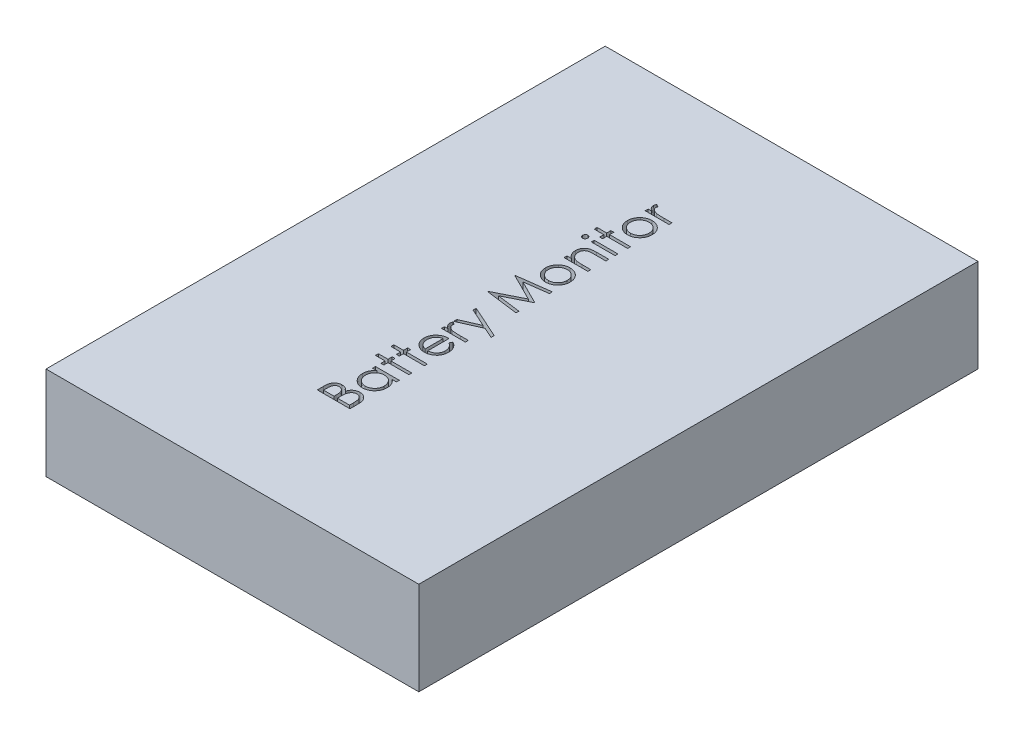
from build123d import *

# Parameters (mm, degrees)
SKETCH1_W           = 40
SKETCH1_H           = 60
BOSS_EXTRUDE1_DEPTH = 10
SKETCH2_W           = 2.557692308
SKETCH2_H           = 0.314102564
CUT_EXTRUDE1_DEPTH  = 2


with BuildPart() as part:
    # Sketch1 → Boss-Extrude1 (new body)
    with BuildSketch(Plane(origin=(0, 0, 0), x_dir=(1, 0, 0), z_dir=(0, 1, 0))):
        Rectangle(SKETCH1_W, SKETCH1_H)
    extrude(amount=BOSS_EXTRUDE1_DEPTH)

    # Sketch2 → Cut-Extrude1 (cut)
    # profile 1 of 15: a face of its own
    with BuildSketch(Plane(origin=(0, 10, 0), x_dir=(1, 0, 0), z_dir=(0, 1, 0))):
        with BuildLine():
            Line((-3.5, -17.387820513), (-3.5, -16.704927885))
            add(Edge.make_bspline(
                [(-3.5, -16.704927885), (-3.499827016, -16.671498879), (-3.499491731, -16.606705147), (-3.494170998, -16.51249287), (-3.487097587, -16.42421924), (-3.47523232, -16.342040248), (-3.462929603, -16.265421167), (-3.44487216, -16.195139841), (-3.424927056, -16.130607579), (-3.394238808, -16.05311754), (-3.346579571, -15.965194473), (-3.275896393, -15.870693627), (-3.191152971, -15.788547726), (-3.094581157, -15.718699361), (-2.988341218, -15.662644562), (-2.874718941, -15.622604427), (-2.755625884, -15.59688112), (-2.673976582, -15.594268894), (-2.63271234, -15.592948718)],
                knots=[0, 0, 0, 0, 1.00128172, 1.940733171, 2.826250472, 3.653024905, 4.427672124, 5.149348099, 5.824709082, 6.450061444, 7.643590664, 8.808605388, 9.972104426, 11.165284501, 12.367876273, 13.557044126, 14.765369432, 16, 16, 16, 16], degree=3))
            add(Edge.make_bspline(
                [(-2.63271234, -15.592948718), (-2.594061484, -15.594048329), (-2.518108906, -15.596209167), (-2.407211066, -15.616620138), (-2.301753702, -15.649015265), (-2.201827071, -15.693786637), (-2.109291316, -15.751472046), (-2.024433087, -15.820587273), (-1.950459558, -15.903628667), (-1.909119745, -15.965876775), (-1.888120994, -15.997495994)],
                knots=[0, 0, 0, 0, 1.044641374, 2.052818814, 3.038628718, 4.023282556, 5.005660861, 5.98021751, 6.974042014, 8, 8, 8, 8], degree=3))
            add(Edge.make_bspline(
                [(-1.888120994, -15.997495994), (-1.872851052, -15.957739405), (-1.84363587, -15.881675204), (-1.792064534, -15.776939381), (-1.73576949, -15.687031894), (-1.675242264, -15.610196446), (-1.609038135, -15.544829368), (-1.536619226, -15.488217699), (-1.458044822, -15.439275808), (-1.37360371, -15.397626597), (-1.284011735, -15.364910622), (-1.190363175, -15.340864835), (-1.093017032, -15.326641228), (-1.026955989, -15.32470091), (-0.993489583, -15.323717949)],
                knots=[0, 0, 0, 0, 1.272586185, 2.434772614, 3.483318042, 4.437947805, 5.351807173, 6.25737843, 7.180033415, 8.1141739, 9.066731021, 10.025721652, 10.999834114, 12, 12, 12, 12], degree=3))
            add(Edge.make_bspline(
                [(-0.993489583, -15.323717949), (-0.959322572, -15.324694581), (-0.89209802, -15.326616133), (-0.793344872, -15.340799155), (-0.698962627, -15.364797053), (-0.608384297, -15.397909437), (-0.521799795, -15.440828598), (-0.439522785, -15.493814705), (-0.361382093, -15.556123939), (-0.28723981, -15.626543446), (-0.21939729, -15.705020476), (-0.161075602, -15.791507215), (-0.110927262, -15.883634346), (-0.070098271, -15.982579628), (-0.038598733, -16.088090474), (-0.016652218, -16.200108171), (-0.001839877, -16.318448244), (-0.000623699, -16.399658589), (0, -16.44130609)],
                knots=[0, 0, 0, 0, 0.978680899, 1.925582087, 2.851223405, 3.764209995, 4.683484765, 5.614004905, 6.562443559, 7.542772147, 8.539900013, 9.527881485, 10.525548727, 11.540192123, 12.58875426, 13.674701727, 14.807505862, 16, 16, 16, 16], degree=3))
            Line((0, -16.44130609), (0, -17.387820513))
            Line((0, -17.387820513), (-3.5, -17.387820513))
        make_face()
        with BuildLine():
            Line((-3.141025641, -17.073717949), (-2.019230769, -17.073717949))
            Line((-2.019230769, -17.073717949), (-2.019230769, -16.862680288))
            add(Edge.make_bspline(
                [(-2.019230769, -16.862680288), (-2.019630692, -16.831831493), (-2.020403425, -16.772225334), (-2.022616943, -16.685905438), (-2.028814983, -16.605780417), (-2.035011254, -16.531988594), (-2.045085813, -16.464646117), (-2.05707803, -16.403902364), (-2.069760632, -16.348803415), (-2.091331398, -16.285265357), (-2.123200398, -16.213182316), (-2.172706503, -16.136389083), (-2.231625018, -16.068375268), (-2.300244736, -16.011630165), (-2.374983675, -15.964778611), (-2.455185698, -15.931957624), (-2.539236842, -15.910076849), (-2.597049479, -15.908070135), (-2.626402244, -15.907051282)],
                knots=[0, 0, 0, 0, 1.156917035, 2.235399477, 3.236897345, 4.169954739, 5.01148057, 5.788325709, 6.491867502, 7.129259015, 8.302032419, 9.437271567, 10.542795419, 11.662606952, 12.764338259, 13.836858145, 14.901724648, 16, 16, 16, 16], degree=3))
            add(Edge.make_bspline(
                [(-2.626402244, -15.907051282), (-2.645830562, -15.907568593), (-2.683941329, -15.908583355), (-2.739678522, -15.917196179), (-2.79205104, -15.931151239), (-2.841561526, -15.950050152), (-2.886979527, -15.975868872), (-2.930475233, -16.00579616), (-2.969443462, -16.042745647), (-3.005760298, -16.084501847), (-3.038263745, -16.132278388), (-3.065187813, -16.187104616), (-3.089589964, -16.247563189), (-3.107654151, -16.315294382), (-3.123538771, -16.388894781), (-3.133519185, -16.469360962), (-3.139941675, -16.556183029), (-3.14065626, -16.616339816), (-3.141025641, -16.647435897)],
                knots=[0, 0, 0, 0, 0.911708768, 1.788416306, 2.640049961, 3.452993646, 4.268229297, 5.087074648, 5.92553149, 6.781184137, 7.681934069, 8.628939405, 9.643570426, 10.73771997, 11.914765019, 13.176320755, 14.540391495, 16, 16, 16, 16], degree=3))
            Line((-3.141025641, -16.647435897), (-3.141025641, -17.073717949))
        make_face(mode=Mode.SUBTRACT)
        with BuildLine():
            Line((-1.66025641, -17.073717949), (-0.358974359, -17.073717949))
            Line((-0.358974359, -17.073717949), (-0.358974359, -16.626402244))
            add(Edge.make_bspline(
                [(-0.358974359, -16.626402244), (-0.359396264, -16.594386666), (-0.36020943, -16.532680862), (-0.362116473, -16.443518122), (-0.369330527, -16.361093696), (-0.375985459, -16.285147566), (-0.387365108, -16.215881293), (-0.398104538, -16.152762077), (-0.414046454, -16.096826064), (-0.435956742, -16.031367986), (-0.471032393, -15.958200986), (-0.522277589, -15.878242624), (-0.585522071, -15.808520172), (-0.657450692, -15.748669955), (-0.735443268, -15.699278957), (-0.818480193, -15.663836244), (-0.904946557, -15.641810879), (-0.963915826, -15.639153312), (-0.993489583, -15.637820513)],
                knots=[0, 0, 0, 0, 1.160376723, 2.23647316, 3.230273494, 4.158083346, 4.997711197, 5.773399541, 6.476071462, 7.102777513, 8.27340052, 9.405620712, 10.53304798, 11.669441455, 12.787990954, 13.865552736, 14.929550474, 16, 16, 16, 16], degree=3))
            add(Edge.make_bspline(
                [(-0.993489583, -15.637820513), (-1.011983322, -15.638095772), (-1.048672494, -15.638641849), (-1.102582506, -15.646914791), (-1.154829834, -15.658883117), (-1.205632199, -15.674645746), (-1.254135426, -15.696681052), (-1.300525527, -15.72369449), (-1.345737015, -15.75461617), (-1.403634242, -15.802322473), (-1.469513255, -15.872724805), (-1.533216158, -15.972774377), (-1.58542007, -16.085906167), (-1.60748965, -16.168151306), (-1.618890224, -16.210637019)],
                knots=[0, 0, 0, 0, 0.723302347, 1.434937762, 2.129609326, 2.821140842, 3.513216847, 4.209993937, 4.920569932, 5.655069131, 7.14393391, 8.6716197, 10.280644748, 12, 12, 12, 12], degree=3))
            add(Edge.make_bspline(
                [(-1.618890224, -16.210637019), (-1.622345308, -16.227666115), (-1.629836643, -16.264588707), (-1.637744346, -16.324796288), (-1.644789406, -16.393532157), (-1.650000564, -16.470955034), (-1.655387107, -16.557162875), (-1.657481929, -16.652339794), (-1.659981189, -16.756097108), (-1.660162323, -16.828089481), (-1.66025641, -16.865484776)],
                knots=[0, 0, 0, 0, 0.634451884, 1.375622551, 2.216452059, 3.157844607, 4.20941857, 5.370758133, 6.634282058, 8, 8, 8, 8], degree=3))
            Line((-1.66025641, -16.865484776), (-1.66025641, -17.073717949))
        make_face(mode=Mode.SUBTRACT)
    # profile 2 of 15: a face of its own
    with BuildSketch(Plane(origin=(0, 10, 0), x_dir=(1, 0, 0), z_dir=(0, 1, 0))):
        with BuildLine():
            Line((-2.557692308, -12.092948718), (0, -12.092948718))
            Line((0, -12.092948718), (0, -12.407051282))
            Line((0, -12.407051282), (-0.442407853, -12.407051282))
            add(Edge.make_bspline(
                [(-0.442407853, -12.407051282), (-0.402434233, -12.442525367), (-0.324309204, -12.51185644), (-0.22130842, -12.626561256), (-0.137906052, -12.749659828), (-0.069567916, -12.878063249), (-0.018442034, -13.013029264), (0.017961997, -13.153852449), (0.041350966, -13.300667344), (0.043687656, -13.400919216), (0.044871795, -13.451722756)],
                knots=[0, 0, 0, 0, 1.074325654, 2.099677833, 3.090439787, 4.057542011, 5.018572219, 5.985274637, 6.979019747, 8, 8, 8, 8], degree=3))
            add(Edge.make_bspline(
                [(0.044871795, -13.451722756), (0.043645423, -13.49689071), (0.041226962, -13.585963915), (0.022464659, -13.716992992), (-0.007665963, -13.843085242), (-0.049566853, -13.964359814), (-0.105147674, -14.08003196), (-0.171688922, -14.191092056), (-0.250929752, -14.296964749), (-0.341517781, -14.396036287), (-0.439912768, -14.487268288), (-0.544858315, -14.56732956), (-0.655900619, -14.63408264), (-0.771633773, -14.689902721), (-0.892948692, -14.732899065), (-1.01942586, -14.7628727), (-1.150915734, -14.781613146), (-1.240455257, -14.784030607), (-1.285857372, -14.78525641)],
                knots=[0, 0, 0, 0, 1.033919861, 2.038935746, 3.024066025, 3.998881131, 4.97069526, 5.957263378, 6.95902576, 7.993208707, 9.027059324, 10.027763471, 11.009749337, 11.988697705, 12.965288445, 13.950418724, 14.960734635, 16, 16, 16, 16], degree=3))
            add(Edge.make_bspline(
                [(-1.285857372, -14.78525641), (-1.330321075, -14.784003439), (-1.418223419, -14.781526382), (-1.547502117, -14.763073162), (-1.672020377, -14.732042154), (-1.791377321, -14.688494306), (-1.905717371, -14.632652351), (-2.015121396, -14.564724264), (-2.119890793, -14.484705139), (-2.21756202, -14.392452732), (-2.307782634, -14.292517962), (-2.38619168, -14.185609231), (-2.453908529, -14.07438595), (-2.507562005, -13.957122939), (-2.550971109, -13.835555834), (-2.581004078, -13.708602389), (-2.598701399, -13.57679081), (-2.601264163, -13.487300318), (-2.602564103, -13.441907051)],
                knots=[0, 0, 0, 0, 1.020392517, 2.01726096, 2.990465484, 3.961182959, 4.928053699, 5.906110375, 6.912531644, 7.948652711, 8.985773172, 9.998621852, 10.987621588, 11.969261332, 12.953316658, 13.946091881, 14.958173133, 16, 16, 16, 16], degree=3))
            add(Edge.make_bspline(
                [(-2.602564103, -13.441907051), (-2.60112475, -13.389708181), (-2.598302246, -13.28734866), (-2.574862161, -13.137606672), (-2.535141118, -12.996013172), (-2.481482841, -12.861065009), (-2.408686533, -12.734619708), (-2.319426341, -12.615103214), (-2.210011935, -12.505058248), (-2.127018146, -12.4402854), (-2.084435096, -12.407051282)],
                knots=[0, 0, 0, 0, 1.039007978, 2.037445607, 3.008437381, 3.96246474, 4.921201921, 5.904967172, 6.925065498, 8, 8, 8, 8], degree=3))
            Line((-2.084435096, -12.407051282), (-2.557692308, -12.407051282))
            Line((-2.557692308, -12.407051282), (-2.557692308, -12.092948718))
        make_face()
        with BuildLine():
            add(Edge.make_bspline(
                [(-2.288461538, -13.437700321), (-2.286826503, -13.48361367), (-2.283599202, -13.57423932), (-2.258445926, -13.707297612), (-2.216485352, -13.834557329), (-2.159435035, -13.95582058), (-2.086337296, -14.067705863), (-2.000214663, -14.1694553), (-1.899613419, -14.257931559), (-1.788133794, -14.334020928), (-1.667961498, -14.395103675), (-1.542380577, -14.438327944), (-1.413564365, -14.466782415), (-1.326203179, -14.469692908), (-1.282351763, -14.471153846)],
                knots=[0, 0, 0, 0, 1.031130969, 2.035288524, 3.029955243, 4.035265425, 5.037320146, 6.024362013, 7.021230137, 8.037832003, 9.049975902, 10.039737725, 11.016035826, 12, 12, 12, 12], degree=3))
            add(Edge.make_bspline(
                [(-1.282351763, -14.471153846), (-1.238764409, -14.469281427), (-1.151760548, -14.465543928), (-1.022955393, -14.438950933), (-0.897656365, -14.39375141), (-0.776518381, -14.332751259), (-0.663949475, -14.255766377), (-0.561541317, -14.167374265), (-0.474071536, -14.065135285), (-0.400797577, -13.952249676), (-0.341644806, -13.831630479), (-0.300476607, -13.704799494), (-0.273899498, -13.574123083), (-0.27079493, -13.485270853), (-0.269230769, -13.440504808)],
                knots=[0, 0, 0, 0, 0.979154007, 1.954470061, 2.941101473, 3.965068436, 4.993389179, 5.998216918, 6.996159742, 8.005560442, 9.015493761, 10.005250788, 10.994993882, 12, 12, 12, 12], degree=3))
            add(Edge.make_bspline(
                [(-0.269230769, -13.440504808), (-0.27090991, -13.395064497), (-0.274249554, -13.304688227), (-0.299260521, -13.171086599), (-0.342149827, -13.041876637), (-0.399788619, -12.917939757), (-0.471579217, -12.802594983), (-0.555626614, -12.699422357), (-0.652700961, -12.611150235), (-0.760626239, -12.537657234), (-0.878190217, -12.479373694), (-1.00322951, -12.436757514), (-1.135997919, -12.411840965), (-1.226858223, -12.408669919), (-1.273237179, -12.407051282)],
                knots=[0, 0, 0, 0, 1.01787422, 2.024450869, 3.03297362, 4.061474925, 5.080076323, 6.069755756, 7.033548292, 8.009625779, 8.9862229, 9.964937832, 10.961217871, 12, 12, 12, 12], degree=3))
            add(Edge.make_bspline(
                [(-1.273237179, -12.407051282), (-1.30857501, -12.408010938), (-1.378131043, -12.409899846), (-1.480258561, -12.424330415), (-1.577992287, -12.447285342), (-1.671434976, -12.479631512), (-1.760069991, -12.522122796), (-1.844533752, -12.573370562), (-1.924386963, -12.634276012), (-1.998530034, -12.703858708), (-2.066156496, -12.78002391), (-2.126520737, -12.860618451), (-2.17610951, -12.946597198), (-2.217150781, -13.036514235), (-2.249809931, -13.130525569), (-2.271597625, -13.229396189), (-2.286557946, -13.332075176), (-2.287820327, -13.402121232), (-2.288461538, -13.437700321)],
                knots=[0, 0, 0, 0, 1.050140795, 2.067009409, 3.05949893, 4.030605086, 5.00011959, 5.97591094, 6.962425594, 7.979863591, 8.993523472, 9.986985069, 10.967611495, 11.937549037, 12.921786183, 13.919465291, 14.943216303, 16, 16, 16, 16], degree=3))
        make_face(mode=Mode.SUBTRACT)
    # profile 3 of 15: a face of its own
    with BuildSketch(Plane(origin=(0, 10, 0), x_dir=(1, 0, 0), z_dir=(0, 1, 0))):
        Polygon((-3.58974359, -11.060897436), (-3.58974359, -10.746794872), (-2.557692308, -10.746794872), (-2.557692308, -10.298076923), (-2.243589744, -10.298076923), (-2.243589744, -10.746794872), (0, -10.746794872), (0, -11.060897436), (-2.243589744, -11.060897436), (-2.243589744, -11.509615385), (-2.557692308, -11.509615385), (-2.557692308, -11.060897436), align=None)
    # profile 4 of 15: a face of its own
    with BuildSketch(Plane(origin=(0, 10, 0), x_dir=(1, 0, 0), z_dir=(0, 1, 0))):
        Polygon((-3.58974359, -9.400641026), (-3.58974359, -9.086538462), (-2.557692308, -9.086538462), (-2.557692308, -8.637820513), (-2.243589744, -8.637820513), (-2.243589744, -9.086538462), (0, -9.086538462), (0, -9.400641026), (-2.243589744, -9.400641026), (-2.243589744, -9.849358974), (-2.557692308, -9.849358974), (-2.557692308, -9.400641026), align=None)
    # profile 5 of 15: a face of its own
    with BuildSketch(Plane(origin=(0, 10, 0), x_dir=(1, 0, 0), z_dir=(0, 1, 0))):
        with BuildLine():
            Line((-0.807692308, -5.955328526), (-0.661157853, -5.676282051))
            add(Edge.make_bspline(
                [(-0.661157853, -5.676282051), (-0.621723871, -5.698530312), (-0.54500096, -5.741816618), (-0.439586991, -5.81595354), (-0.345319457, -5.894382008), (-0.26370785, -5.979488285), (-0.191634668, -6.068707762), (-0.129467518, -6.163734993), (-0.07608468, -6.263794328), (-0.032342426, -6.369987873), (0.002045853, -6.482188416), (0.027441832, -6.601047025), (0.042169086, -6.727124907), (0.043956532, -6.81346287), (0.044871795, -6.857672276)],
                knots=[0, 0, 0, 0, 1.120611642, 2.180266485, 3.186550691, 4.152466804, 5.095166165, 6.022949561, 6.960161436, 7.899497276, 8.862391909, 9.862399089, 10.905440174, 12, 12, 12, 12], degree=3))
            add(Edge.make_bspline(
                [(0.044871795, -6.857672276), (0.04372462, -6.906814253), (0.041486813, -7.002676015), (0.022194349, -7.142215763), (-0.009278012, -7.273595177), (-0.053243547, -7.396806895), (-0.110670893, -7.511549095), (-0.180630295, -7.618050146), (-0.26276285, -7.71686893), (-0.357778154, -7.804895955), (-0.459464338, -7.884129391), (-0.565404947, -7.954092971), (-0.675233097, -8.0123127), (-0.788295336, -8.060394679), (-0.90433474, -8.09832225), (-1.024015882, -8.125274166), (-1.146864189, -8.140667314), (-1.229959798, -8.143036728), (-1.271834936, -8.144230769)],
                knots=[0, 0, 0, 0, 1.14524686, 2.234044844, 3.276713788, 4.290115724, 5.276966211, 6.260758605, 7.254862358, 8.264742877, 9.274005885, 10.257798278, 11.220590477, 12.167824544, 13.118936889, 14.062732937, 15.023735098, 16, 16, 16, 16], degree=3))
            add(Edge.make_bspline(
                [(-1.271834936, -8.144230769), (-1.311129766, -8.143171628), (-1.389006931, -8.14107255), (-1.504272476, -8.127841762), (-1.616300928, -8.104393469), (-1.725185376, -8.072217145), (-1.83074351, -8.030665899), (-1.933039574, -7.97983368), (-2.031964713, -7.919641302), (-2.094367847, -7.873168628), (-2.125801282, -7.849759615)],
                knots=[0, 0, 0, 0, 1.024358464, 2.0301432, 3.019427413, 4.004406732, 4.986367066, 5.972626655, 6.978780325, 8, 8, 8, 8], degree=3))
            add(Edge.make_bspline(
                [(-2.125801282, -7.849759615), (-2.163732941, -7.818106596), (-2.238272838, -7.755904919), (-2.335322662, -7.649608159), (-2.418340489, -7.536058379), (-2.486066597, -7.414113405), (-2.538158683, -7.283978646), (-2.575211094, -7.146325327), (-2.598266796, -7.000772979), (-2.601109889, -6.900995252), (-2.602564103, -6.849959936)],
                knots=[0, 0, 0, 0, 1.030811313, 2.025658015, 2.997072178, 3.962767568, 4.930766827, 5.917075773, 6.934604948, 8, 8, 8, 8], degree=3))
            add(Edge.make_bspline(
                [(-2.602564103, -6.849959936), (-2.601216835, -6.797509315), (-2.598573804, -6.694613153), (-2.573851652, -6.544623642), (-2.535122917, -6.402421735), (-2.478696987, -6.269180954), (-2.408753193, -6.142848252), (-2.320347513, -6.026331164), (-2.218020567, -5.916431219), (-2.13924476, -5.852529335), (-2.099158654, -5.820012019)],
                knots=[0, 0, 0, 0, 1.056389096, 2.072394598, 3.055233004, 4.020130009, 4.981825462, 5.957811105, 6.960805292, 8, 8, 8, 8], degree=3))
            add(Edge.make_bspline(
                [(-2.099158654, -5.820012019), (-2.068955072, -5.797885081), (-2.008748954, -5.753778488), (-1.910577797, -5.698531388), (-1.807867202, -5.650573993), (-1.698956905, -5.612241032), (-1.585137325, -5.581201531), (-1.46559478, -5.558744712), (-1.340364869, -5.545575093), (-1.255038314, -5.542986396), (-1.211538462, -5.541666667)],
                knots=[0, 0, 0, 0, 0.94817472, 1.890038105, 2.849395472, 3.817997239, 4.812318967, 5.836947057, 6.897266129, 8, 8, 8, 8], degree=3))
            Line((-1.211538462, -5.541666667), (-1.211538462, -7.830128205))
            add(Edge.make_bspline(
                [(-1.211538462, -7.830128205), (-1.177837997, -7.828588599), (-1.111567394, -7.825561025), (-1.01459661, -7.811445882), (-0.922223268, -7.789197108), (-0.835140226, -7.757928045), (-0.752210099, -7.7200612), (-0.674048062, -7.673675483), (-0.601010132, -7.618335929), (-0.532442994, -7.55661023), (-0.471382233, -7.487903134), (-0.416730457, -7.415620387), (-0.37092486, -7.338726822), (-0.33374497, -7.257828739), (-0.304638654, -7.173056954), (-0.284770834, -7.084384758), (-0.271463727, -6.991986642), (-0.269984061, -6.929000908), (-0.269230769, -6.896935096)],
                knots=[0, 0, 0, 0, 1.094153842, 2.151609401, 3.174256925, 4.172055639, 5.149267565, 6.128595816, 7.11444997, 8.118368179, 9.117203808, 10.09244225, 11.054858984, 12.015122123, 12.976791628, 13.957293641, 14.960065497, 16, 16, 16, 16], degree=3))
            add(Edge.make_bspline(
                [(-0.269230769, -6.896935096), (-0.269833929, -6.865582581), (-0.271030715, -6.803373175), (-0.282834755, -6.710752469), (-0.301543133, -6.619471648), (-0.328488888, -6.530437108), (-0.360042003, -6.444946416), (-0.397179816, -6.365339997), (-0.439521127, -6.29267029), (-0.487636723, -6.224485955), (-0.546687196, -6.158708548), (-0.61966842, -6.092424039), (-0.707408148, -6.022918314), (-0.773006325, -5.978706278), (-0.807692308, -5.955328526)],
                knots=[0, 0, 0, 0, 0.991168677, 1.966668791, 2.94808785, 3.9350306, 4.905702032, 5.828266021, 6.709360349, 7.562606342, 8.463112863, 9.498839253, 10.677475166, 12, 12, 12, 12], degree=3))
        make_face()
        with BuildLine():
            add(Edge.make_bspline(
                [(-1.525641026, -5.855769231), (-1.567324719, -5.867219299), (-1.647343869, -5.88919971), (-1.75811233, -5.936010814), (-1.857124106, -5.987458864), (-1.942733842, -6.049392191), (-2.018888471, -6.118879009), (-2.084375044, -6.200249753), (-2.144732764, -6.28997528), (-2.194996376, -6.389842742), (-2.236300966, -6.495913863), (-2.266672607, -6.606008464), (-2.284525968, -6.719204401), (-2.287143515, -6.795444608), (-2.288461538, -6.833834135)],
                knots=[0, 0, 0, 0, 1.155085888, 2.217389643, 3.210301801, 4.133263417, 5.03575695, 5.95948047, 6.920061569, 7.923798377, 8.943125483, 9.960783337, 10.973185325, 12, 12, 12, 12], degree=3))
            add(Edge.make_bspline(
                [(-2.288461538, -6.833834135), (-2.287857, -6.865185969), (-2.286661954, -6.927161953), (-2.275088768, -7.018428409), (-2.256491944, -7.106303742), (-2.229148178, -7.190525648), (-2.195876219, -7.271652801), (-2.154978249, -7.349626582), (-2.105531888, -7.423444623), (-2.067760071, -7.469580794), (-2.048677885, -7.492888622)],
                knots=[0, 0, 0, 0, 1.048823158, 2.073302879, 3.073550078, 4.050623576, 5.03253758, 6.005186856, 6.992227572, 8, 8, 8, 8], degree=3))
            add(Edge.make_bspline(
                [(-2.048677885, -7.492888622), (-2.033585155, -7.50958452), (-2.00304115, -7.543372949), (-1.950387182, -7.588472636), (-1.893576633, -7.631976026), (-1.83012967, -7.670635127), (-1.761886187, -7.707374864), (-1.688348228, -7.740854289), (-1.609205387, -7.771295333), (-1.554028674, -7.788383736), (-1.525641026, -7.797175481)],
                knots=[0, 0, 0, 0, 0.879905587, 1.780714457, 2.708106151, 3.677566983, 4.684151534, 5.740052498, 6.837288539, 8, 8, 8, 8], degree=3))
            Line((-1.525641026, -7.797175481), (-1.525641026, -5.855769231))
        make_face(mode=Mode.SUBTRACT)
    # profile 6 of 15: a face of its own
    with BuildSketch(Plane(origin=(0, 10, 0), x_dir=(1, 0, 0), z_dir=(0, 1, 0))):
        with BuildLine():
            Line((-2.557692308, -5.003205128), (-2.557692308, -4.689102564))
            Line((-2.557692308, -4.689102564), (-2.181189904, -4.689102564))
            add(Edge.make_bspline(
                [(-2.181189904, -4.689102564), (-2.216261426, -4.665928643), (-2.283335439, -4.621608698), (-2.371926058, -4.54759888), (-2.446113212, -4.472599306), (-2.504482141, -4.394640624), (-2.548594798, -4.314487159), (-2.57959138, -4.232814802), (-2.598813304, -4.149423835), (-2.601312162, -4.093248373), (-2.602564103, -4.065104167)],
                knots=[0, 0, 0, 0, 1.280091057, 2.448164201, 3.510831157, 4.48793739, 5.405868014, 6.289422536, 7.142991551, 8, 8, 8, 8], degree=3))
            add(Edge.make_bspline(
                [(-2.602564103, -4.065104167), (-2.601373576, -4.04327784), (-2.59892399, -3.998368755), (-2.581713165, -3.930386165), (-2.554235143, -3.860342713), (-2.52839492, -3.815200326), (-2.514923878, -3.791666667)],
                knots=[0, 0, 0, 0, 0.901110191, 1.854092781, 2.881294221, 4, 4, 4, 4], degree=3))
            Line((-2.514923878, -3.791666667), (-2.242888622, -3.964142628))
            add(Edge.make_bspline(
                [(-2.242888622, -3.964142628), (-2.249628888, -3.979251649), (-2.262423203, -4.007931464), (-2.277565213, -4.04988603), (-2.286481129, -4.088567367), (-2.287831847, -4.113210925), (-2.288461538, -4.124699519)],
                knots=[0, 0, 0, 0, 1.180555205, 2.24091978, 3.179933427, 4, 4, 4, 4], degree=3))
            add(Edge.make_bspline(
                [(-2.288461538, -4.124699519), (-2.286794658, -4.14991282), (-2.283394705, -4.201340646), (-2.256284039, -4.27659198), (-2.213741221, -4.350267355), (-2.165297528, -4.408215589), (-2.118763125, -4.453242453), (-2.078035261, -4.485624631), (-2.031944456, -4.514688119), (-1.982272224, -4.542880473), (-1.927771932, -4.569073299), (-1.868354671, -4.592480436), (-1.804511084, -4.614370616), (-1.76011915, -4.626698156), (-1.737379808, -4.633012821)],
                knots=[0, 0, 0, 0, 1.125322384, 2.295331465, 3.535939348, 4.916963136, 5.656144286, 6.429838446, 7.238666481, 8.090384391, 8.983239461, 9.940052224, 10.944811494, 12, 12, 12, 12], degree=3))
            add(Edge.make_bspline(
                [(-1.737379808, -4.633012821), (-1.717103757, -4.637753393), (-1.671968634, -4.648306054), (-1.596591234, -4.658292447), (-1.507592607, -4.66855683), (-1.404869363, -4.675566371), (-1.288026631, -4.682187817), (-1.157568472, -4.685845776), (-1.013136318, -4.688986181), (-0.912395458, -4.689062532), (-0.859575321, -4.689102564)],
                knots=[0, 0, 0, 0, 0.566841273, 1.261806378, 2.068780918, 3.007109044, 4.065315289, 5.256255371, 6.561408263, 8, 8, 8, 8], degree=3))
            Line((-0.859575321, -4.689102564), (0, -4.689102564))
            Line((0, -4.689102564), (0, -5.003205128))
            Line((0, -5.003205128), (-2.557692308, -5.003205128))
        make_face()
    # profile 7 of 15: a face of its own
    with BuildSketch(Plane(origin=(0, 10, 0), x_dir=(1, 0, 0), z_dir=(0, 1, 0))):
        Polygon((-2.557692308, -3.701923077), (-2.557692308, -3.36328125), (-0.598758013, -2.497395833), (-2.557692308, -1.618189103), (-2.557692308, -1.278846154), (0.942307692, -2.849358974), (0.942307692, -3.188701923), (-0.218048878, -2.667768429), align=None)
    # profile 8 of 15: a face of its own
    with BuildSketch(Plane(origin=(0, 10, 0), x_dir=(1, 0, 0), z_dir=(0, 1, 0))):
        Polygon((0, 0.426282051), (-3.5, 0.888321314), (-3.5, 0.933193109), (-0.628205128, 2.378205128), (-3.5, 3.819711538), (-3.5, 3.865284455), (0, 4.330128205), (0, 4.014623397), (-2.518429487, 3.679487179), (0, 2.416065705), (0, 2.345252404), (-2.524038462, 1.076923077), (0, 0.742487981), align=None)
    # profile 9 of 15: a face of its own
    with BuildSketch(Plane(origin=(0, 10, 0), x_dir=(1, 0, 0), z_dir=(0, 1, 0))):
        with BuildLine():
            add(Edge.make_bspline(
                [(-2.602564103, 6.193709936), (-2.601542211, 6.241701209), (-2.599538533, 6.335800366), (-2.578123567, 6.473608252), (-2.545376203, 6.605153388), (-2.500104641, 6.73093958), (-2.43942269, 6.849355876), (-2.367013399, 6.96212712), (-2.281230805, 7.068944129), (-2.214872737, 7.132967158), (-2.181189904, 7.165464744)],
                knots=[0, 0, 0, 0, 1.054011418, 2.066658804, 3.057071809, 4.030435133, 4.997543892, 5.974964718, 6.972108034, 8, 8, 8, 8], degree=3))
            add(Edge.make_bspline(
                [(-2.181189904, 7.165464744), (-2.148975918, 7.193446698), (-2.085171376, 7.248869078), (-1.981715763, 7.319934797), (-1.874575662, 7.381156357), (-1.762328336, 7.430219318), (-1.645953664, 7.468904342), (-1.525051653, 7.496370038), (-1.399889306, 7.512706973), (-1.314885468, 7.51490994), (-1.271834936, 7.516025641)],
                knots=[0, 0, 0, 0, 1.025258237, 2.030674902, 3.01204498, 3.988269485, 4.97094183, 5.956517959, 6.965070386, 8, 8, 8, 8], degree=3))
            add(Edge.make_bspline(
                [(-1.271834936, 7.516025641), (-1.228534878, 7.515044304), (-1.142971945, 7.513105135), (-1.016952579, 7.494761519), (-0.894757756, 7.466230433), (-0.776899063, 7.425398595), (-0.663016235, 7.373040486), (-0.553606686, 7.309149798), (-0.448454553, 7.233278181), (-0.348452714, 7.147274184), (-0.2562865, 7.052222308), (-0.17595823, 6.94910616), (-0.107136706, 6.839952126), (-0.05170029, 6.723308773), (-0.00799059, 6.600241286), (0.022709427, 6.470484218), (0.04127111, 6.334239148), (0.043654684, 6.241211926), (0.044871795, 6.193709936)],
                knots=[0, 0, 0, 0, 0.998656419, 1.973391657, 2.932242238, 3.890759089, 4.846373663, 5.82037756, 6.809684879, 7.83454468, 8.860553229, 9.859544525, 10.845671541, 11.83227036, 12.833544569, 13.85385346, 14.904124723, 16, 16, 16, 16], degree=3))
            add(Edge.make_bspline(
                [(0.044871795, 6.193709936), (0.043650599, 6.145975216), (0.041258824, 6.052484357), (0.022781541, 5.915758375), (-0.007976441, 5.785768756), (-0.051843934, 5.662540157), (-0.107138478, 5.54539531), (-0.175750167, 5.435608813), (-0.256310322, 5.332408898), (-0.348446259, 5.237336913), (-0.448456216, 5.151338308), (-0.553606254, 5.0754653), (-0.663016348, 5.011574974), (-0.776899033, 4.95921677), (-0.894757764, 4.918384957), (-1.016952577, 4.889853864), (-1.142971945, 4.87151025), (-1.228534878, 4.869571081), (-1.271834936, 4.868589744)],
                knots=[0, 0, 0, 0, 1.099876186, 2.154163076, 3.173186993, 4.173200201, 5.163417411, 6.152872554, 7.150605724, 8.17532212, 9.198891216, 10.186952605, 11.159729845, 12.11414092, 13.071450619, 14.029093627, 15.002601286, 16, 16, 16, 16], degree=3))
            add(Edge.make_bspline(
                [(-1.271834936, 4.868589744), (-1.314652437, 4.869710385), (-1.399423731, 4.871929063), (-1.52433693, 4.888288293), (-1.644868911, 4.915455141), (-1.760608083, 4.95467645), (-1.872585626, 5.003648335), (-1.98011856, 5.064253727), (-2.083122115, 5.136006887), (-2.146842045, 5.191213953), (-2.179086538, 5.219150641)],
                knots=[0, 0, 0, 0, 1.031377469, 2.041950136, 3.029500481, 4.003457997, 4.981637986, 5.969878303, 6.97268806, 8, 8, 8, 8], degree=3))
            add(Edge.make_bspline(
                [(-2.179086538, 5.219150641), (-2.213061478, 5.251599232), (-2.279879174, 5.315415096), (-2.365411698, 5.422763824), (-2.439327772, 5.535257645), (-2.498803987, 5.654982571), (-2.545642505, 5.780665429), (-2.57820802, 5.912884671), (-2.599461375, 6.051160187), (-2.601519553, 6.145719808), (-2.602564103, 6.193709936)],
                knots=[0, 0, 0, 0, 1.027980169, 2.021703884, 2.998553061, 3.971491411, 4.943284454, 5.930300938, 6.949603206, 8, 8, 8, 8], degree=3))
        make_face()
        with BuildLine():
            add(Edge.make_bspline(
                [(-2.288461538, 6.192307692), (-2.287496947, 6.158370081), (-2.285592664, 6.091370952), (-2.271108759, 5.992751368), (-2.248161257, 5.897811211), (-2.215557194, 5.806370381), (-2.173458319, 5.718737155), (-2.121749868, 5.634827953), (-2.061117263, 5.554394738), (-1.99165323, 5.479015677), (-1.915779287, 5.409822224), (-1.834912684, 5.349384487), (-1.750292131, 5.297703713), (-1.66179029, 5.255431907), (-1.569105401, 5.223012434), (-1.47278329, 5.20003938), (-1.372533096, 5.185528954), (-1.304369985, 5.1836481), (-1.269731571, 5.182692308)],
                knots=[0, 0, 0, 0, 1.02155314, 2.01673505, 2.994700672, 3.958461264, 4.934171024, 5.916582427, 6.921469794, 7.962398674, 8.998583302, 10.009097305, 10.997513862, 11.97957236, 12.956600784, 13.948243505, 14.957359924, 16, 16, 16, 16], degree=3))
            add(Edge.make_bspline(
                [(-1.269731571, 5.182692308), (-1.224979543, 5.184299131), (-1.136155138, 5.187488376), (-1.005344015, 5.213423612), (-0.879762163, 5.256809892), (-0.760145777, 5.315397172), (-0.649473499, 5.38880339), (-0.550802015, 5.475290457), (-0.465616203, 5.573930158), (-0.394935358, 5.683546658), (-0.338775602, 5.801900976), (-0.298976626, 5.927157297), (-0.273104934, 6.057797991), (-0.270533459, 6.147078722), (-0.269230769, 6.192307692)],
                knots=[0, 0, 0, 0, 1.016792936, 2.018143844, 3.017858371, 4.030088057, 5.03801393, 6.028138512, 7.003788237, 7.991172063, 8.984598303, 9.972568034, 10.972917682, 12, 12, 12, 12], degree=3))
            add(Edge.make_bspline(
                [(-0.269230769, 6.192307692), (-0.270541049, 6.237534061), (-0.273127506, 6.326809657), (-0.298846326, 6.457268834), (-0.338949987, 6.582182806), (-0.394872197, 6.700414193), (-0.465884611, 6.809980797), (-0.550320988, 6.909329918), (-0.64973484, 6.995078529), (-0.760292369, 7.068412134), (-0.879576721, 7.127958877), (-1.005367193, 7.171142079), (-1.136149235, 7.197139665), (-1.224977566, 7.200320493), (-1.269731571, 7.201923077)],
                knots=[0, 0, 0, 0, 1.02726834, 2.027799167, 3.010890988, 4.004497153, 4.992059811, 5.971914811, 6.958719428, 7.966827853, 8.981595046, 9.981490638, 10.983022906, 12, 12, 12, 12], degree=3))
            add(Edge.make_bspline(
                [(-1.269731571, 7.201923077), (-1.304370192, 7.200967614), (-1.37253371, 7.199087409), (-1.472780943, 7.184572264), (-1.569113987, 7.161616636), (-1.661758671, 7.129133081), (-1.750521749, 7.087049045), (-1.834664636, 7.034374767), (-1.916059349, 6.974183883), (-1.991407949, 6.904155624), (-2.06114434, 6.828855239), (-2.12177338, 6.748389429), (-2.173231066, 6.66460465), (-2.215917283, 6.577226015), (-2.247864629, 6.485773461), (-2.271241259, 6.390966328), (-2.285531456, 6.292767519), (-2.287478598, 6.226008476), (-2.288461538, 6.192307692)],
                knots=[0, 0, 0, 0, 1.042975879, 2.052417305, 3.044379404, 4.0217225, 5.00409729, 5.996508862, 7.007348322, 8.048612455, 9.089876587, 10.095087598, 11.077815406, 12.047498138, 13.018202342, 13.98964644, 14.985148868, 16, 16, 16, 16], degree=3))
        make_face(mode=Mode.SUBTRACT)
    # profile 10 of 15: a face of its own
    with BuildSketch(Plane(origin=(0, 10, 0), x_dir=(1, 0, 0), z_dir=(0, 1, 0))):
        with BuildLine():
            Line((-2.557692308, 8.144230769), (-2.557692308, 8.458333333))
            Line((-2.557692308, 8.458333333), (-2.096354167, 8.458333333))
            add(Edge.make_bspline(
                [(-2.096354167, 8.458333333), (-2.138259455, 8.491813075), (-2.219450404, 8.556679638), (-2.325322597, 8.665816274), (-2.414166302, 8.779613315), (-2.484117946, 8.899919005), (-2.537022548, 9.025495371), (-2.575173001, 9.155986094), (-2.598061986, 9.292097456), (-2.60105165, 9.384662349), (-2.602564103, 9.431490385)],
                knots=[0, 0, 0, 0, 1.127869841, 2.185233117, 3.191641716, 4.159226741, 5.10472073, 6.052603964, 7.014823782, 8, 8, 8, 8], degree=3))
            add(Edge.make_bspline(
                [(-2.602564103, 9.431490385), (-2.600920109, 9.478844895), (-2.597700803, 9.571575555), (-2.569252618, 9.706083177), (-2.524495803, 9.832477895), (-2.460946021, 9.948896669), (-2.382464341, 10.054090635), (-2.290894531, 10.146145937), (-2.186120249, 10.222907414), (-2.088348776, 10.274215599), (-2.001464733, 10.307371333), (-1.927156305, 10.329164837), (-1.844332361, 10.34679483), (-1.75319979, 10.362592458), (-1.65339191, 10.373131095), (-1.545147134, 10.381484963), (-1.428484143, 10.387460243), (-1.347797639, 10.387697939), (-1.306189904, 10.387820513)],
                knots=[0, 0, 0, 0, 1.235846195, 2.420061613, 3.574938557, 4.72781258, 5.870749808, 6.993217613, 8.10690044, 9.251157787, 9.865716151, 10.534141144, 11.271861846, 12.076851687, 12.949307443, 13.892392281, 14.913166647, 16, 16, 16, 16], degree=3))
            Line((-1.306189904, 10.387820513), (0, 10.387820513))
            Line((0, 10.387820513), (0, 10.073717949))
            Line((0, 10.073717949), (-1.203125, 10.073717949))
            add(Edge.make_bspline(
                [(-1.203125, 10.073717949), (-1.237947495, 10.07352554), (-1.304557001, 10.073157496), (-1.399925376, 10.071981473), (-1.486180825, 10.06921317), (-1.563571239, 10.065163262), (-1.631813366, 10.059494414), (-1.691252631, 10.053425809), (-1.741362537, 10.046065484), (-1.77152758, 10.039502072), (-1.78505609, 10.036558494)],
                knots=[0, 0, 0, 0, 1.430803381, 2.736883362, 3.918614142, 4.976458302, 5.92063272, 6.731858525, 7.431260095, 8, 8, 8, 8], degree=3))
            add(Edge.make_bspline(
                [(-1.78505609, 10.036558494), (-1.824795804, 10.025985705), (-1.901079039, 10.005690479), (-2.004374389, 9.954520462), (-2.093030698, 9.891402794), (-2.165224631, 9.81320145), (-2.221425751, 9.722016726), (-2.260391137, 9.617697035), (-2.284769891, 9.501322033), (-2.287196662, 9.419467122), (-2.288461538, 9.376802885)],
                knots=[0, 0, 0, 0, 1.084232, 2.08126119, 3.027460722, 3.945137793, 4.874029258, 5.839697328, 6.874011781, 8, 8, 8, 8], degree=3))
            add(Edge.make_bspline(
                [(-2.288461538, 9.376802885), (-2.287992381, 9.351532955), (-2.287063931, 9.301524418), (-2.27751279, 9.227407192), (-2.262414052, 9.155292976), (-2.240162758, 9.085345943), (-2.212851267, 9.017339079), (-2.179994601, 8.950795056), (-2.13954707, 8.887249517), (-2.094328751, 8.825656787), (-2.044256989, 8.768341112), (-1.991410553, 8.715013515), (-1.935135453, 8.667475301), (-1.876335372, 8.624406677), (-1.81420357, 8.5872284), (-1.749339254, 8.554775315), (-1.681657107, 8.52723962), (-1.634682046, 8.513556927), (-1.611177885, 8.506710737)],
                knots=[0, 0, 0, 0, 1.023827899, 2.026128959, 3.023898047, 4.006668367, 4.997079741, 5.992687789, 7.009920206, 8.046337072, 9.087246971, 10.092051999, 11.086713115, 12.070168086, 13.043348831, 14.017773728, 15.008185103, 16, 16, 16, 16], degree=3))
            add(Edge.make_bspline(
                [(-1.611177885, 8.506710737), (-1.593922682, 8.502771089), (-1.556359007, 8.49419468), (-1.494714588, 8.4849315), (-1.423404613, 8.476523924), (-1.342512296, 8.469486966), (-1.251754421, 8.465181549), (-1.151518583, 8.460487153), (-1.041405094, 8.458778092), (-0.964743402, 8.458485738), (-0.924779647, 8.458333333)],
                knots=[0, 0, 0, 0, 0.615963638, 1.340920617, 2.168419149, 3.115676021, 4.16674242, 5.331190069, 6.6087489, 8, 8, 8, 8], degree=3))
            Line((-0.924779647, 8.458333333), (0, 8.458333333))
            Line((0, 8.458333333), (0, 8.144230769))
            Line((0, 8.144230769), (-2.557692308, 8.144230769))
        make_face()
    # profile 11 of 15: a face of its own
    with BuildSketch(Plane(origin=(0, 10, 0), x_dir=(1, 0, 0), z_dir=(0, 1, 0))):
        with BuildLine():
            add(Edge.make_bspline(
                [(-3.634615385, 11.216546474), (-3.633711232, 11.23603779), (-3.631940728, 11.27420553), (-3.616779251, 11.329398798), (-3.591079566, 11.37965581), (-3.556599885, 11.424233543), (-3.516050441, 11.462485429), (-3.468789473, 11.48926614), (-3.417730834, 11.506478536), (-3.382115745, 11.508557091), (-3.363982372, 11.509615385)],
                knots=[0, 0, 0, 0, 1.055194115, 2.066272739, 3.074728998, 4.095836921, 5.109056067, 6.073838105, 7.019297344, 8, 8, 8, 8], degree=3))
            add(Edge.make_bspline(
                [(-3.363982372, 11.509615385), (-3.346319719, 11.508533225), (-3.311402744, 11.506393923), (-3.261229272, 11.489279435), (-3.214624988, 11.462257197), (-3.174154278, 11.424258071), (-3.139693658, 11.37964931), (-3.113988919, 11.329400524), (-3.098828782, 11.274205076), (-3.097058093, 11.236037637), (-3.096153846, 11.216546474)],
                knots=[0, 0, 0, 0, 0.96129708, 1.900370562, 2.859976407, 3.87933698, 4.906634145, 5.921202961, 6.938410037, 8, 8, 8, 8], degree=3))
            add(Edge.make_bspline(
                [(-3.096153846, 11.216546474), (-3.097023566, 11.197278199), (-3.098716363, 11.159775019), (-3.114286381, 11.105408177), (-3.139702454, 11.055579687), (-3.173928639, 11.010915015), (-3.214873536, 10.973684822), (-3.26120083, 10.946586496), (-3.311409985, 10.929511534), (-3.346322151, 10.927366906), (-3.363982372, 10.926282051)],
                knots=[0, 0, 0, 0, 1.054934014, 2.053291228, 3.073705704, 4.106921865, 5.123545215, 6.088680038, 7.033164197, 8, 8, 8, 8], degree=3))
            add(Edge.make_bspline(
                [(-3.363982372, 10.926282051), (-3.382113221, 10.927343138), (-3.417723354, 10.929427179), (-3.468818387, 10.946599295), (-3.515799889, 10.973459103), (-3.556825388, 11.010939666), (-3.591070823, 11.055573127), (-3.616481804, 11.105409872), (-3.632053144, 11.159774571), (-3.633745758, 11.197278047), (-3.634615385, 11.216546474)],
                knots=[0, 0, 0, 0, 0.98631895, 1.937192651, 2.907499808, 3.917963147, 4.944918757, 5.95915025, 6.951458133, 8, 8, 8, 8], degree=3))
        make_face()
    # profile 12 of 15: a face of its own
    with BuildSketch(Plane(origin=(0, 10, 0), x_dir=(1, 0, 0), z_dir=(0, 1, 0))):
        with Locations((-1.278846154, 11.217948718)):
            Rectangle(SKETCH2_W, SKETCH2_H)
    # profile 13 of 15: a face of its own
    with BuildSketch(Plane(origin=(0, 10, 0), x_dir=(1, 0, 0), z_dir=(0, 1, 0))):
        Polygon((-3.58974359, 12.407051282), (-3.58974359, 12.721153846), (-2.557692308, 12.721153846), (-2.557692308, 13.169871795), (-2.243589744, 13.169871795), (-2.243589744, 12.721153846), (0, 12.721153846), (0, 12.407051282), (-2.243589744, 12.407051282), (-2.243589744, 11.958333333), (-2.557692308, 11.958333333), (-2.557692308, 12.407051282), align=None)
    # profile 14 of 15: a face of its own
    with BuildSketch(Plane(origin=(0, 10, 0), x_dir=(1, 0, 0), z_dir=(0, 1, 0))):
        with BuildLine():
            add(Edge.make_bspline(
                [(-2.602564103, 14.988581731), (-2.601542211, 15.036573004), (-2.599538533, 15.130672161), (-2.578123567, 15.268480047), (-2.545376203, 15.400025183), (-2.500104641, 15.525811375), (-2.43942269, 15.644227671), (-2.367013399, 15.756998915), (-2.281230805, 15.863815924), (-2.214872737, 15.927838953), (-2.181189904, 15.960336538)],
                knots=[0, 0, 0, 0, 1.054011418, 2.066658804, 3.057071809, 4.030435133, 4.997543892, 5.974964718, 6.972108034, 8, 8, 8, 8], degree=3))
            add(Edge.make_bspline(
                [(-2.181189904, 15.960336538), (-2.148975918, 15.988318493), (-2.085171376, 16.043740873), (-1.981715763, 16.114806592), (-1.874575662, 16.176028152), (-1.762328336, 16.225091113), (-1.645953664, 16.263776136), (-1.525051653, 16.291241833), (-1.399889306, 16.307578768), (-1.314885468, 16.309781735), (-1.271834936, 16.310897436)],
                knots=[0, 0, 0, 0, 1.025258237, 2.030674902, 3.01204498, 3.988269485, 4.97094183, 5.956517959, 6.965070386, 8, 8, 8, 8], degree=3))
            add(Edge.make_bspline(
                [(-1.271834936, 16.310897436), (-1.228534878, 16.309916099), (-1.142971945, 16.30797693), (-1.016952579, 16.289633314), (-0.894757756, 16.261102228), (-0.776899063, 16.22027039), (-0.663016235, 16.167912281), (-0.553606686, 16.104021593), (-0.448454553, 16.028149976), (-0.348452714, 15.942145979), (-0.2562865, 15.847094103), (-0.17595823, 15.743977955), (-0.107136706, 15.634823921), (-0.05170029, 15.518180568), (-0.00799059, 15.395113081), (0.022709427, 15.265356013), (0.04127111, 15.129110942), (0.043654684, 15.036083721), (0.044871795, 14.988581731)],
                knots=[0, 0, 0, 0, 0.998656419, 1.973391657, 2.932242238, 3.890759089, 4.846373663, 5.82037756, 6.809684879, 7.83454468, 8.860553229, 9.859544525, 10.845671541, 11.83227036, 12.833544569, 13.85385346, 14.904124723, 16, 16, 16, 16], degree=3))
            add(Edge.make_bspline(
                [(0.044871795, 14.988581731), (0.043650599, 14.940847011), (0.041258824, 14.847356152), (0.022781541, 14.71063017), (-0.007976441, 14.580640551), (-0.051843934, 14.457411952), (-0.107138478, 14.340267105), (-0.175750167, 14.230480608), (-0.256310322, 14.127280693), (-0.348446259, 14.032208708), (-0.448456216, 13.946210103), (-0.553606254, 13.870337095), (-0.663016348, 13.806446768), (-0.776899033, 13.754088565), (-0.894757764, 13.713256752), (-1.016952577, 13.684725659), (-1.142971945, 13.666382044), (-1.228534878, 13.664442876), (-1.271834936, 13.663461538)],
                knots=[0, 0, 0, 0, 1.099876186, 2.154163076, 3.173186993, 4.173200201, 5.163417411, 6.152872554, 7.150605724, 8.17532212, 9.198891216, 10.186952605, 11.159729845, 12.11414092, 13.071450619, 14.029093627, 15.002601286, 16, 16, 16, 16], degree=3))
            add(Edge.make_bspline(
                [(-1.271834936, 13.663461538), (-1.314652437, 13.66458218), (-1.399423731, 13.666800858), (-1.52433693, 13.683160088), (-1.644868911, 13.710326936), (-1.760608083, 13.749548245), (-1.872585626, 13.79852013), (-1.98011856, 13.859125521), (-2.083122115, 13.930878682), (-2.146842045, 13.986085747), (-2.179086538, 14.014022436)],
                knots=[0, 0, 0, 0, 1.031377469, 2.041950136, 3.029500481, 4.003457997, 4.981637986, 5.969878303, 6.97268806, 8, 8, 8, 8], degree=3))
            add(Edge.make_bspline(
                [(-2.179086538, 14.014022436), (-2.213061478, 14.046471027), (-2.279879174, 14.110286891), (-2.365411698, 14.217635619), (-2.439327772, 14.33012944), (-2.498803987, 14.449854366), (-2.545642505, 14.575537224), (-2.57820802, 14.707756466), (-2.599461375, 14.846031982), (-2.601519553, 14.940591603), (-2.602564103, 14.988581731)],
                knots=[0, 0, 0, 0, 1.027980169, 2.021703884, 2.998553061, 3.971491411, 4.943284454, 5.930300938, 6.949603206, 8, 8, 8, 8], degree=3))
        make_face()
        with BuildLine():
            add(Edge.make_bspline(
                [(-2.288461538, 14.987179487), (-2.287496947, 14.953241876), (-2.285592664, 14.886242747), (-2.271108759, 14.787623163), (-2.248161257, 14.692683006), (-2.215557194, 14.601242175), (-2.173458319, 14.51360895), (-2.121749868, 14.429699748), (-2.061117263, 14.349266533), (-1.99165323, 14.273887472), (-1.915779287, 14.204694019), (-1.834912684, 14.144256282), (-1.750292131, 14.092575507), (-1.66179029, 14.050303702), (-1.569105401, 14.017884229), (-1.47278329, 13.994911175), (-1.372533096, 13.980400749), (-1.304369985, 13.978519895), (-1.269731571, 13.977564103)],
                knots=[0, 0, 0, 0, 1.02155314, 2.01673505, 2.994700672, 3.958461264, 4.934171024, 5.916582427, 6.921469794, 7.962398674, 8.998583302, 10.009097305, 10.997513862, 11.97957236, 12.956600784, 13.948243505, 14.957359924, 16, 16, 16, 16], degree=3))
            add(Edge.make_bspline(
                [(-1.269731571, 13.977564103), (-1.224979543, 13.979170926), (-1.136155138, 13.982360171), (-1.005344015, 14.008295407), (-0.879762163, 14.051681687), (-0.760145777, 14.110268967), (-0.649473499, 14.183675185), (-0.550802015, 14.270162252), (-0.465616203, 14.368801952), (-0.394935358, 14.478418453), (-0.338775602, 14.596772771), (-0.298976626, 14.722029092), (-0.273104934, 14.852669786), (-0.270533459, 14.941950517), (-0.269230769, 14.987179487)],
                knots=[0, 0, 0, 0, 1.016792936, 2.018143844, 3.017858371, 4.030088057, 5.03801393, 6.028138512, 7.003788237, 7.991172063, 8.984598303, 9.972568034, 10.972917682, 12, 12, 12, 12], degree=3))
            add(Edge.make_bspline(
                [(-0.269230769, 14.987179487), (-0.270541049, 15.032405856), (-0.273127506, 15.121681452), (-0.298846326, 15.252140629), (-0.338949987, 15.377054601), (-0.394872197, 15.495285988), (-0.465884611, 15.604852592), (-0.550320988, 15.704201713), (-0.64973484, 15.789950324), (-0.760292369, 15.863283929), (-0.879576721, 15.922830672), (-1.005367193, 15.966013874), (-1.136149235, 15.992011459), (-1.224977566, 15.995192288), (-1.269731571, 15.996794872)],
                knots=[0, 0, 0, 0, 1.02726834, 2.027799167, 3.010890988, 4.004497153, 4.992059811, 5.971914811, 6.958719428, 7.966827853, 8.981595046, 9.981490638, 10.983022906, 12, 12, 12, 12], degree=3))
            add(Edge.make_bspline(
                [(-1.269731571, 15.996794872), (-1.304370192, 15.995839409), (-1.37253371, 15.993959204), (-1.472780943, 15.979444059), (-1.569113987, 15.956488431), (-1.661758671, 15.924004876), (-1.750521749, 15.88192084), (-1.834664636, 15.829246562), (-1.916059349, 15.769055678), (-1.991407949, 15.699027419), (-2.06114434, 15.623727034), (-2.12177338, 15.543261224), (-2.173231066, 15.459476445), (-2.215917283, 15.37209781), (-2.247864629, 15.280645256), (-2.271241259, 15.185838123), (-2.285531456, 15.087639314), (-2.287478598, 15.020880271), (-2.288461538, 14.987179487)],
                knots=[0, 0, 0, 0, 1.042975879, 2.052417305, 3.044379404, 4.0217225, 5.00409729, 5.996508862, 7.007348322, 8.048612455, 9.089876587, 10.095087598, 11.077815406, 12.047498138, 13.018202342, 13.98964644, 14.985148868, 16, 16, 16, 16], degree=3))
        make_face(mode=Mode.SUBTRACT)
    # profile 15 of 15: a face of its own
    with BuildSketch(Plane(origin=(0, 10, 0), x_dir=(1, 0, 0), z_dir=(0, 1, 0))):
        with BuildLine():
            Line((-2.557692308, 16.849358974), (-2.557692308, 17.163461538))
            Line((-2.557692308, 17.163461538), (-2.181189904, 17.163461538))
            add(Edge.make_bspline(
                [(-2.181189904, 17.163461538), (-2.216261426, 17.18663546), (-2.283335439, 17.230955405), (-2.371926058, 17.304965223), (-2.446113212, 17.379964797), (-2.504482141, 17.457923478), (-2.548594798, 17.538076943), (-2.57959138, 17.6197493), (-2.598813304, 17.703140267), (-2.601312162, 17.759315729), (-2.602564103, 17.787459936)],
                knots=[0, 0, 0, 0, 1.280091057, 2.448164201, 3.510831157, 4.48793739, 5.405868014, 6.289422536, 7.142991551, 8, 8, 8, 8], degree=3))
            add(Edge.make_bspline(
                [(-2.602564103, 17.787459936), (-2.601373576, 17.809286262), (-2.59892399, 17.854195348), (-2.581713165, 17.922177937), (-2.554235143, 17.992221389), (-2.52839492, 18.037363777), (-2.514923878, 18.060897436)],
                knots=[0, 0, 0, 0, 0.901110191, 1.854092781, 2.881294221, 4, 4, 4, 4], degree=3))
            Line((-2.514923878, 18.060897436), (-2.242888622, 17.888421474))
            add(Edge.make_bspline(
                [(-2.242888622, 17.888421474), (-2.249628888, 17.873312453), (-2.262423203, 17.844632639), (-2.277565213, 17.802678072), (-2.286481129, 17.763996736), (-2.287831847, 17.739353177), (-2.288461538, 17.727864583)],
                knots=[0, 0, 0, 0, 1.180555205, 2.24091978, 3.179933427, 4, 4, 4, 4], degree=3))
            add(Edge.make_bspline(
                [(-2.288461538, 17.727864583), (-2.286794658, 17.702651282), (-2.283394705, 17.651223456), (-2.256284039, 17.575972122), (-2.213741221, 17.502296748), (-2.165297528, 17.444348514), (-2.118763125, 17.39932165), (-2.078035261, 17.366939471), (-2.031944456, 17.337875984), (-1.982272224, 17.30968363), (-1.927771932, 17.283490804), (-1.868354671, 17.260083667), (-1.804511084, 17.238193487), (-1.76011915, 17.225865946), (-1.737379808, 17.219551282)],
                knots=[0, 0, 0, 0, 1.125322384, 2.295331465, 3.535939348, 4.916963136, 5.656144286, 6.429838446, 7.238666481, 8.090384391, 8.983239461, 9.940052224, 10.944811494, 12, 12, 12, 12], degree=3))
            add(Edge.make_bspline(
                [(-1.737379808, 17.219551282), (-1.717103757, 17.21481071), (-1.671968634, 17.204258049), (-1.596591234, 17.194271656), (-1.507592607, 17.184007272), (-1.404869363, 17.176997732), (-1.288026631, 17.170376286), (-1.157568472, 17.166718326), (-1.013136318, 17.163577922), (-0.912395458, 17.163501571), (-0.859575321, 17.163461538)],
                knots=[0, 0, 0, 0, 0.566841273, 1.261806378, 2.068780918, 3.007109044, 4.065315289, 5.256255371, 6.561408263, 8, 8, 8, 8], degree=3))
            Line((-0.859575321, 17.163461538), (0, 17.163461538))
            Line((0, 17.163461538), (0, 16.849358974))
            Line((0, 16.849358974), (-2.557692308, 16.849358974))
        make_face()
    extrude(amount=-CUT_EXTRUDE1_DEPTH, mode=Mode.SUBTRACT)


solid = part.part
